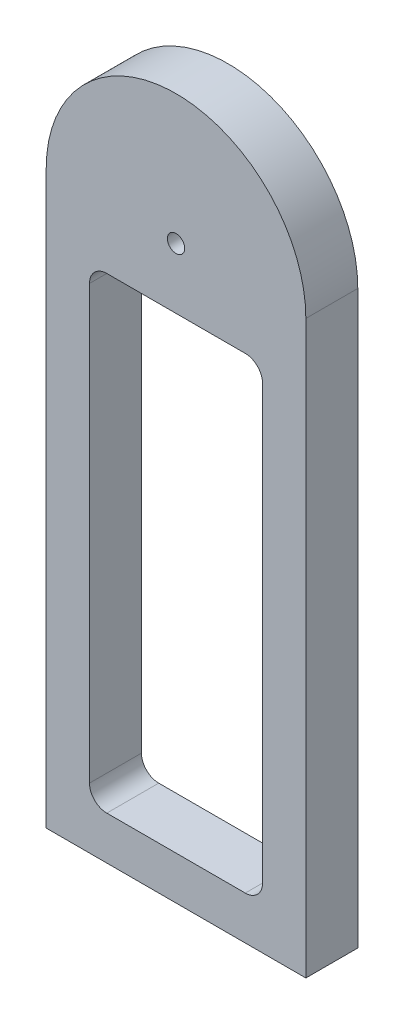
from build123d import *

# Parameters (mm, degrees)
SKETCH1_R           = 5
SKETCH1_W           = 100
SKETCH1_H           = 270
BOSS_EXTRUDE1_DEPTH = 30
FILLET1_R           = 10


with BuildPart() as part:
    # Sketch1 → Boss-Extrude1 (new body)
    with BuildSketch(Plane.XY):
        with BuildLine():
            Line((0, 0), (150, 0))
            Line((150, 0), (150, 330))
            ThreePointArc((150, 330), (75, 405), (0, 330))
            Line((0, 330), (0, 0))
        make_face()
        with Locations((75, 330)):
            Circle(SKETCH1_R, mode=Mode.SUBTRACT)
        with Locations((75, 160)):
            Rectangle(SKETCH1_W, SKETCH1_H, mode=Mode.SUBTRACT)
    extrude(amount=BOSS_EXTRUDE1_DEPTH)

    # Fillet1
    fillet1_edges = [part.edges().sort_by_distance(p)[0] for p in [
        (125, 295, 15),
        (25, 295, 15),
        (25, 25, 15),
        (125, 25, 15),
    ]]
    fillet(fillet1_edges, radius=FILLET1_R)


solid = part.part
